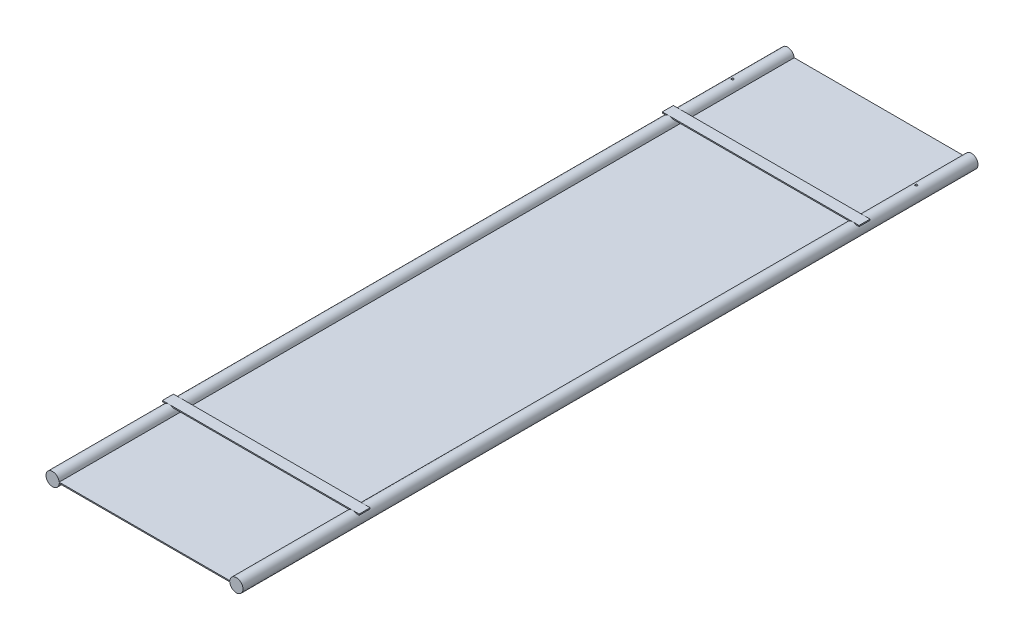
from build123d import *

# Parameters (mm, degrees)
SKETCH_1_R               = 15
EXTRUDE_1_DEPTH          = 2000
EXTRUDE_1_2_DEPTH        = 2000
SKETCH_2_R               = 15
EXTRUDE_2_DEPTH          = 2000
CUT_EXTRUDE_1_DEPTH      = 2018.973628535
CUT_EXTRUDE_1_DEPTH_BACK = 2018.973628535
SKETCH_3_R               = 3
SKETCH_6_W               = 535.348800536
SKETCH_6_H               = 30
EXTRUDE_3_DEPTH          = 3


with BuildPart() as part:
    # 草图1 → 凸台-拉伸1 (new body)
    with BuildSketch(Plane.XY):
        with Locations((-250, 0)):
            Circle(SKETCH_1_R)
    extrude(amount=EXTRUDE_1_DEPTH)



with BuildPart() as body_2:
    # 草图1 → Extrude 1 2 (new body)
    with BuildSketch(Plane.XY):
        with Locations((250, 0)):
            Circle(SKETCH_1_R)
    extrude(amount=EXTRUDE_1_2_DEPTH)


with BuildPart() as part_1:
    add(part.part)

    add(body_2.part)  # 凸台-拉伸2 merges body 2
    # 草图2 → 凸台-拉伸2 (add)
    with BuildSketch(Plane(origin=(0, 0, 0), x_dir=(-1, 0, 0), z_dir=(0, 0, -1))):
        with BuildLine():
            Line((-232.09413573, 1.83848436), (232.09413573, 1.83848436))
            ThreePointArc((232.09413573, 1.83848436), (267.996794905, -0.339666233), (232.037514609, -1.16151564))
            Line((232.037514609, -1.16151564), (-232.037514609, -1.16151564))
            ThreePointArc((-232.037514609, -1.16151564), (-267.996794905, -0.339666233), (-232.09413573, 1.83848436))
        make_face()
        with Locations((-250, 0)):
            Circle(SKETCH_2_R, mode=Mode.SUBTRACT)
        with Locations((250, 0)):
            Circle(SKETCH_2_R, mode=Mode.SUBTRACT)
    extrude(amount=-EXTRUDE_2_DEPTH)

    # 草图3 → 切除-拉伸1 (cut, two sides: drawn at the far end of the back side and taken through both)
    with BuildSketch(Plane(origin=(0, 1.83848436, 0), x_dir=(1, 0, 0), z_dir=(0, 1, 0)).offset(-CUT_EXTRUDE_1_DEPTH_BACK)):
        with Locations(Location((250.018757305, -150, 0), (0, 0, 180))):
            Circle(SKETCH_3_R)
        with Locations(Location((-250.018757305, -150, 0), (0, 0, 180))):
            Circle(SKETCH_3_R)
    extrude(amount=CUT_EXTRUDE_1_DEPTH + CUT_EXTRUDE_1_DEPTH_BACK, mode=Mode.SUBTRACT)

    # 草图6 → 凸台-拉伸3 (add)
    with BuildSketch(Plane(origin=(0, 18, 0), x_dir=(1, 0, 0), z_dir=(0, 1, 0))):
        with Locations((-0.325599732, -308.023795678)):
            Rectangle(SKETCH_6_W, SKETCH_6_H)
        with Locations((-0.325599732, -1668.181126051)):
            Rectangle(SKETCH_6_W, SKETCH_6_H)
    extrude(amount=-EXTRUDE_3_DEPTH)


solid = part_1.part
